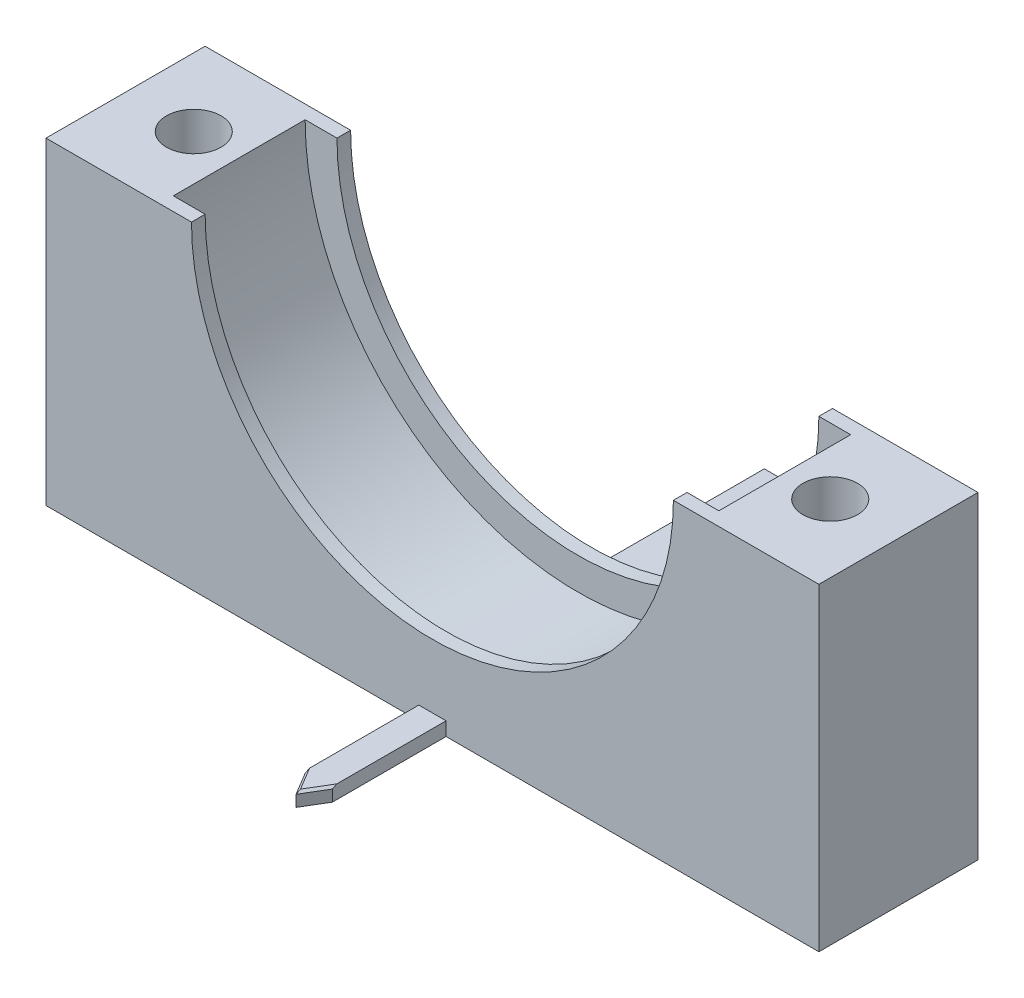
from build123d import *

# Parameters (mm, degrees)
DODANIE_WYCI_GNI_CIE1_DEPTH = 14.5
OTW_R_12_0_12_1_D           = 12
OTW_R_12_0_12_1_DEPTH       = 20
OTW_R_12_0_12_1_TIP         = 3.605163714
DODANIE_WYCI_GNI_CIE2_DEPTH = 3
DODANIE_WYCI_GNI_CIE3_START = 3
DODANIE_WYCI_GNI_CIE3_DEPTH = 3
DODANIE_WYCI_GNI_CIE4_DEPTH = 3
SZKIC7_W                    = 20
SZKIC7_H                    = 20
DODANIE_WYCI_GNI_CIE5_DEPTH = 3
SZKIC8_W                    = 20
SZKIC8_H                    = 30
DODANIE_WYCI_GNI_CIE6_DEPTH = 3
SZKIC9_R                    = 2
WYTNIJ_WYCI_GNI_CIE1_DEPTH  = 8
SZKIC10_R                   = 4
DODANIE_WYCI_GNI_CIE7_DEPTH = 5
WYTNIJ_WYCI_GNI_CIE2_START  = -5
SZKIC13_R                   = 2
WYTNIJ_WYCI_GNI_CIE2_DEPTH  = 5
DODANIE_WYCI_GNI_CIE8_DEPTH = 3
SFAZOWANIE1_SIZE            = 0.5
SZKIC18_R                   = 5
DODANIE_WYCI_GNI_CIE9_DEPTH = 10
SFAZOWANIE2_SIZE            = 1


with BuildPart() as part:
    # Szkic1 → Dodanie-wyciągnięcie1 (new, symmetric)
    with BuildSketch(Plane.XY):
        with BuildLine():
            Line((-60, 0), (-85, 0))
            Line((-85, 0), (-85, -30.5))
            Line((-85, -30.5), (-85, -70))
            Line((-85, -70), (85, -70))
            Line((85, -70), (85, -30.5))
            Line((85, -30.5), (85, 0))
            Line((85, 0), (60, 0))
            ThreePointArc((60, 0), (0, -60), (-60, 0))
        make_face()
    extrude(amount=DODANIE_WYCI_GNI_CIE1_DEPTH, both=True)

    # Otwór Ø12.0 (12)1
    with Locations(Plane(origin=(0, 0, 0), x_dir=(1, 0, 0), z_dir=(0, 1, 0))):
        with Locations((-70, 0), (70, 0)):
            Hole(OTW_R_12_0_12_1_D / 2, depth=OTW_R_12_0_12_1_DEPTH)
            with Locations((0, 0, -(OTW_R_12_0_12_1_DEPTH + OTW_R_12_0_12_1_TIP / 2))):  # 118° drill point
                Cone(0, OTW_R_12_0_12_1_D / 2, OTW_R_12_0_12_1_TIP, mode=Mode.SUBTRACT)

    # Szkic4 → Dodanie-wyciągnięcie2 (add)
    with BuildSketch(Plane(origin=(0, 0, -14.5), x_dir=(-1, 0, 0), z_dir=(0, 0, -1))):
        with BuildLine():
            Line((-53, 0), (-85, 0))
            Line((-85, 0), (-85, -70))
            Line((-85, -70), (85, -70))
            Line((85, -70), (85, 0))
            Line((85, 0), (53, 0))
            ThreePointArc((53, 0), (0, -53), (-53, 0))
        make_face()
    extrude(amount=DODANIE_WYCI_GNI_CIE2_DEPTH)

    # Szkic5 → Dodanie-wyciągnięcie3 (add)
    with BuildSketch(Plane.XY.offset(14.5).offset(DODANIE_WYCI_GNI_CIE3_START)):
        with BuildLine():
            Line((-53, 0), (-85, 0))
            Line((-85, 0), (-85, -70))
            Line((-85, -70), (85, -70))
            Line((85, -70), (85, 0))
            Line((85, 0), (53, 0))
            ThreePointArc((53, 0), (0, -53), (-53, 0))
        make_face()
    extrude(amount=-DODANIE_WYCI_GNI_CIE3_DEPTH)

    # Szkic6 → Dodanie-wyciągnięcie4 (add)
    with BuildSketch(Plane(origin=(0, -70, 0), x_dir=(1, 0, 0), z_dir=(0, 1, 0))):
        Polygon((0, 17.5), (-10, 17.5), (-10, 62.5), (10, 62.5), (10, 17.5), align=None)
    extrude(amount=DODANIE_WYCI_GNI_CIE4_DEPTH)

    # Szkic7 → Dodanie-wyciągnięcie5 (add)
    with BuildSketch(Plane(origin=(0, 0, -62.5), x_dir=(-1, 0, 0), z_dir=(0, 0, -1))):
        with Locations((0, -77)):
            Rectangle(SZKIC7_W, SZKIC7_H)
    extrude(amount=DODANIE_WYCI_GNI_CIE5_DEPTH)

    # Szkic8 → Dodanie-wyciągnięcie6 (add)
    with BuildSketch(Plane.XZ.offset(87)):
        with Locations((0, -50.5)):
            Rectangle(SZKIC8_W, SZKIC8_H)
    extrude(amount=DODANIE_WYCI_GNI_CIE6_DEPTH)

    # Szkic9 → Wytnij-wyciągnięcie1 (cut)
    with BuildSketch(Plane.XZ.offset(90)):
        with Locations(Location((0, -40.997300871, 0), (0, 0, 270))):
            Circle(SZKIC9_R)
    extrude(amount=-WYTNIJ_WYCI_GNI_CIE1_DEPTH, mode=Mode.SUBTRACT)

    # Szkic10 → Dodanie-wyciągnięcie7 (add)
    with BuildSketch(Plane(origin=(0, -87, 0), x_dir=(1, 0, 0), z_dir=(0, 1, 0))):
        with Locations(Location((0, 40.997300871, 0), (0, 0, 90))):
            Circle(SZKIC10_R)
    extrude(amount=DODANIE_WYCI_GNI_CIE7_DEPTH)

    # Szkic13 → Wytnij-wyciągnięcie2 (cut)
    with BuildSketch(Plane(origin=(0, -82, 0), x_dir=(1, 0, 0), z_dir=(0, 1, 0)).offset(WYTNIJ_WYCI_GNI_CIE2_START)):
        with Locations(Location((0, 40.997300871, 0), (0, 0, 90))):
            Circle(SZKIC13_R)
    extrude(amount=WYTNIJ_WYCI_GNI_CIE2_DEPTH, mode=Mode.SUBTRACT)

    # Szkic14 → Dodanie-wyciągnięcie8 (add)
    with BuildSketch(Plane(origin=(0, -70, 0), x_dir=(1, 0, 0), z_dir=(0, 1, 0))):
        Polygon((3, -17.5), (-3, -17.5), (-3, -42.5), (0, -47.5), (3, -42.5), align=None)
    extrude(amount=DODANIE_WYCI_GNI_CIE8_DEPTH)

    # Sfazowanie1
    sfazowanie1_edges = [part.edges().sort_by_distance(p)[0] for p in [
        (1.5, -67, 45),
        (-1.5, -67, 45),
    ]]
    chamfer(sfazowanie1_edges, length=SFAZOWANIE1_SIZE)

    # Szkic18 → Dodanie-wyciągnięcie9 (add)
    with BuildSketch(Plane(origin=(0, -70, 0), x_dir=(-1, 0, 0), z_dir=(0, -1, 0))):
        with Locations(Location((0, 0, 0), (0, 0, 270))):
            Circle(SZKIC18_R)
    extrude(amount=DODANIE_WYCI_GNI_CIE9_DEPTH)

    # Sfazowanie2
    sfazowanie2_edges = [part.edges().sort_by_distance(p)[0] for p in [
        (0, -80, -5),
    ]]
    chamfer(sfazowanie2_edges, length=SFAZOWANIE2_SIZE)


solid = part.part
